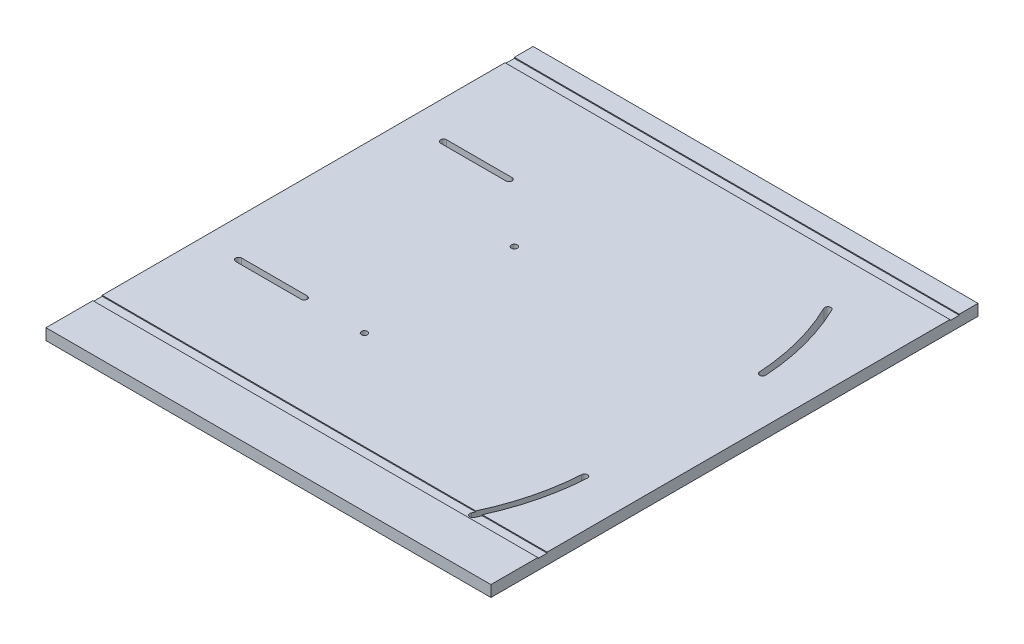
from build123d import *

# Parameters (mm, degrees)
SKETCH1_W           = 603.25
SKETCH1_H           = 660.4
BOSS_EXTRUDE1_DEPTH = 19.05
CHAMFER1_SIZE       = 3.81
CUT_EXTRUDE2_DEPTH  = 448.629962274
SKETCH6_R           = 4.064
CUT_EXTRUDE5_DEPTH  = 448.629962274
CUT_EXTRUDE8_DEPTH  = 448.629962274
SKETCH10_W          = 603.25
SKETCH10_H          = 12.7
CUT_EXTRUDE9_DEPTH  = 1.27


with BuildPart() as part:
    # Sketch1 → Boss-Extrude1 (new body)
    with BuildSketch(Plane(origin=(0, 0, 0), x_dir=(1, 0, 0), z_dir=(0, 1, 0))):
        Rectangle(SKETCH1_W, SKETCH1_H)
    extrude(amount=BOSS_EXTRUDE1_DEPTH)

    # Chamfer1
    chamfer1_edges = [part.edges().sort_by_distance(p)[0] for p in [
        (0, 0, 330.2),
        (-301.625, 0, 0),
        (0, 0, -330.2),
        (301.625, 0, 0),
    ]]
    chamfer(chamfer1_edges, length=CHAMFER1_SIZE)

    # Sketch3 → Cut-Extrude2 (cut, through all)
    with BuildSketch(Plane(origin=(0, 19.05, 0), x_dir=(1, 0, 0), z_dir=(0, 1, 0))):
        with BuildLine():
            Line((-250.825, 162.004445849), (-161.925, 162.004445849))
            ThreePointArc((-161.925, 162.004445849), (-157.861, 157.940445849), (-161.925, 153.876445849))
            Line((-161.925, 153.876445849), (-250.825, 153.876445849))
            ThreePointArc((-250.825, 153.876445849), (-254.889, 157.940445849), (-250.825, 162.004445849))
        make_face()
        with BuildLine():
            Line((-250.825, -123.904445849), (-161.925, -123.904445849))
            ThreePointArc((-161.925, -123.904445849), (-157.861, -119.840445849), (-161.925, -115.776445849))
            Line((-161.925, -115.776445849), (-250.825, -115.776445849))
            ThreePointArc((-250.825, -115.776445849), (-254.889, -119.840445849), (-250.825, -123.904445849))
        make_face()
    extrude(amount=-CUT_EXTRUDE2_DEPTH, mode=Mode.SUBTRACT)

    # Sketch6 → Cut-Extrude5 (cut, through all)
    with BuildSketch(Plane(origin=(0, 19.05, 0), x_dir=(1, 0, 0), z_dir=(0, 1, 0))):
        with Locations(Location((-79.375, 82.55, 0), (0, 0, 270))):
            Circle(SKETCH6_R)
        with Locations(Location((-79.375, -120.65, 0), (0, 0, 270))):
            Circle(SKETCH6_R)
    extrude(amount=-CUT_EXTRUDE5_DEPTH, mode=Mode.SUBTRACT)

    # Sketch9 → Cut-Extrude8 (cut, through all)
    with BuildSketch(Plane(origin=(0, 19.05, 0), x_dir=(1, 0, 0), z_dir=(0, 1, 0))):
        with BuildLine():
            ThreePointArc((242.118601729, -139.943450479), (232.177226853, -202.293022526), (210.263074619, -261.505099002))
            ThreePointArc((210.263074619, -261.505099002), (204.8309841, -263.382486707), (202.953596395, -257.950396188))
            ThreePointArc((202.953596395, -257.950396188), (224.314710087, -200.23263079), (234.005198531, -139.456549521))
            ThreePointArc((234.005198531, -139.456549521), (238.305350609, -135.643298401), (242.118601729, -139.943450479))
        make_face()
        with BuildLine():
            ThreePointArc((242.118601729, 101.843450479), (232.177226853, 164.193022526), (210.263074619, 223.405099002))
            ThreePointArc((210.263074619, 223.405099002), (204.8309841, 225.282486707), (202.953596395, 219.850396188))
            ThreePointArc((202.953596395, 219.850396188), (224.314710087, 162.13263079), (234.005198531, 101.356549521))
            ThreePointArc((234.005198531, 101.356549521), (238.305350609, 97.543298401), (242.118601729, 101.843450479))
        make_face()
    extrude(amount=-CUT_EXTRUDE8_DEPTH, mode=Mode.SUBTRACT)

    # Sketch10 → Cut-Extrude9 (cut)
    with BuildSketch(Plane(origin=(0, 19.05, 0), x_dir=(1, 0, 0), z_dir=(0, 1, 0))):
        with Locations((0, 298.45)):
            Rectangle(SKETCH10_W, SKETCH10_H)
        with Locations((0, -260.35)):
            Rectangle(SKETCH10_W, SKETCH10_H)
    extrude(amount=-CUT_EXTRUDE9_DEPTH, mode=Mode.SUBTRACT)


solid = part.part
